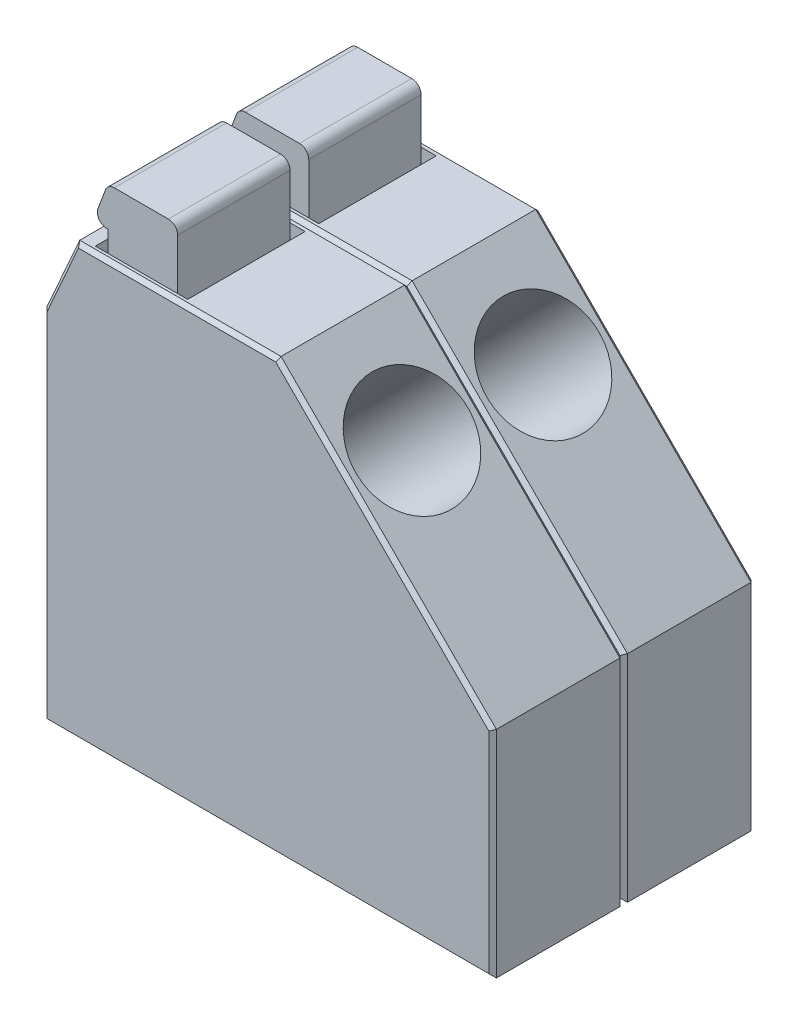
from build123d import *

# Parameters (mm, degrees)
BOSS_EXTRUDE1_DEPTH = 3.5
SKETCH2_R           = 1.5
CUT_EXTRUDE1_DEPTH  = 5
SKETCH3_W           = 2.463564272
SKETCH3_H           = 3.137802915
CUT_EXTRUDE2_DEPTH  = 2
BOSS_EXTRUDE2_DEPTH = 3
FILLET1_R           = 0.25
CHAMFER1_SIZE       = 0.1
LPATTERN1_COUNT     = 2
LPATTERN1_PITCH     = 3.5
SKETCH9_R           = 0.755713579
CUT_EXTRUDE3_DEPTH  = 0.2


with BuildPart() as part:
    # Sketch1 → Boss-Extrude1 (new body)
    with BuildSketch(Plane.XY):
        Polygon((0, 0), (12, 0), (12, 5.75), (6.25, 11.5), (0.875138122, 11.5), (0, 9.527071823), align=None)
    extrude(amount=BOSS_EXTRUDE1_DEPTH)

    # Sketch2 → Cut-Extrude1 (cut)
    with BuildSketch(Plane(origin=(8.875, 8.875, 0), x_dir=(0, 0, -1), z_dir=(0.7071067811865464, 0.7071067811865488, 0))):
        with Locations(Location((-1.75, 1.10118655, 0), (0, 0, 90))):
            Circle(SKETCH2_R)
    extrude(amount=-CUT_EXTRUDE1_DEPTH, mode=Mode.SUBTRACT)

    # Sketch3 → Cut-Extrude2 (cut)
    with BuildSketch(Plane(origin=(0, 11.5, 0), x_dir=(1, 0, 0), z_dir=(0, 1, 0))):
        with Locations((2.451603039, -1.758644086)):
            Rectangle(SKETCH3_W, SKETCH3_H)
    extrude(amount=-CUT_EXTRUDE2_DEPTH, mode=Mode.SUBTRACT)

    # Chamfer1
    chamfer1_edges = [part.edges().sort_by_distance(p)[0] for p in [
        (3.562569061, 11.5, 3.5),
        (0.437569061, 10.513535912, 3.5),
        (0, 4.763535912, 3.5),
        (6, 0, 3.5),
        (12, 2.875, 3.5),
        (6, 0, 0),
        (0, 4.763535912, 0),
        (0.437569061, 10.513535912, 0),
        (9.125, 8.625, 3.5),
        (3.562569061, 11.5, 0),
        (9.125, 8.625, 0),
        (12, 2.875, 0),
    ]]
    chamfer(chamfer1_edges, length=CHAMFER1_SIZE)


with BuildPart() as body_2:
    # Sketch5 → Boss-Extrude2 (new body)
    with BuildSketch(Plane(origin=(0, 0, 3.327545543), x_dir=(-1, 0, 0), z_dir=(0, 0, -1))):
        Polygon((-3.417684047, 9.5), (-3.417684047, 13.1), (-1.55035862, 13.1), (-1.160013757, 12.059784232), (-1.55035862, 12.059784232), (-1.55035862, 9.5), align=None)
    extrude(amount=BOSS_EXTRUDE2_DEPTH)

    # Fillet1
    fillet1_edges = [body_2.edges().sort_by_distance(p)[0] for p in [
        (3.417684047, 13.1, 1.827545543),
        (1.55035862, 13.1, 1.827545543),
        (1.160013757, 12.059784232, 1.827545543),
    ]]
    fillet(fillet1_edges, radius=FILLET1_R)


with BuildPart() as lpattern1_1:
    # LPattern1: pattern copy
    add(body_2.part.moved(Location(Vector(0, 0, 1) * (1 * LPATTERN1_PITCH))))


with BuildPart() as lpattern1_2:
    # LPattern1: pattern copy
    add(part.part.moved(Location(Vector(0, 0, 1) * (1 * LPATTERN1_PITCH))))


with BuildPart() as part_1:
    add(part.part)

    # Sketch9 → Cut-Extrude3 (cut)
    with BuildSketch(Plane(origin=(0, 0, 0), x_dir=(-1, 0, 0), z_dir=(0, 0, -1))):
        with Locations((-7.824779814, 2.638779832)):
            Circle(SKETCH9_R)
        with Locations((-2.362615501, 8.130785084)):
            Circle(SKETCH9_R)
    extrude(amount=-CUT_EXTRUDE3_DEPTH, mode=Mode.SUBTRACT)


solid = Compound([body_2.part, lpattern1_1.part, lpattern1_2.part, part_1.part])
